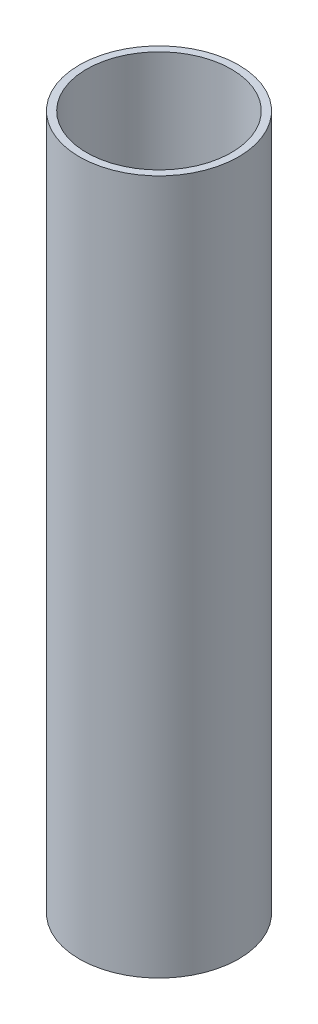
from build123d import *

# Parameters (mm, degrees)
SKETCH1_R           = 17.4625
SKETCH1_R_2         = 15.875
BOSS_EXTRUDE1_DEPTH = 152.4


with BuildPart() as part:
    # Sketch1 → Boss-Extrude1 (new body)
    with BuildSketch(Plane(origin=(0, 0, 0), x_dir=(1, 0, 0), z_dir=(0, 1, 0))):
        with Locations(Location((0, 0, 0), (0, 0, 90))):
            Circle(SKETCH1_R)
        with Locations(Location((0, 0, 0), (0, 0, 90))):
            Circle(SKETCH1_R_2, mode=Mode.SUBTRACT)
    extrude(amount=BOSS_EXTRUDE1_DEPTH)


solid = part.part
